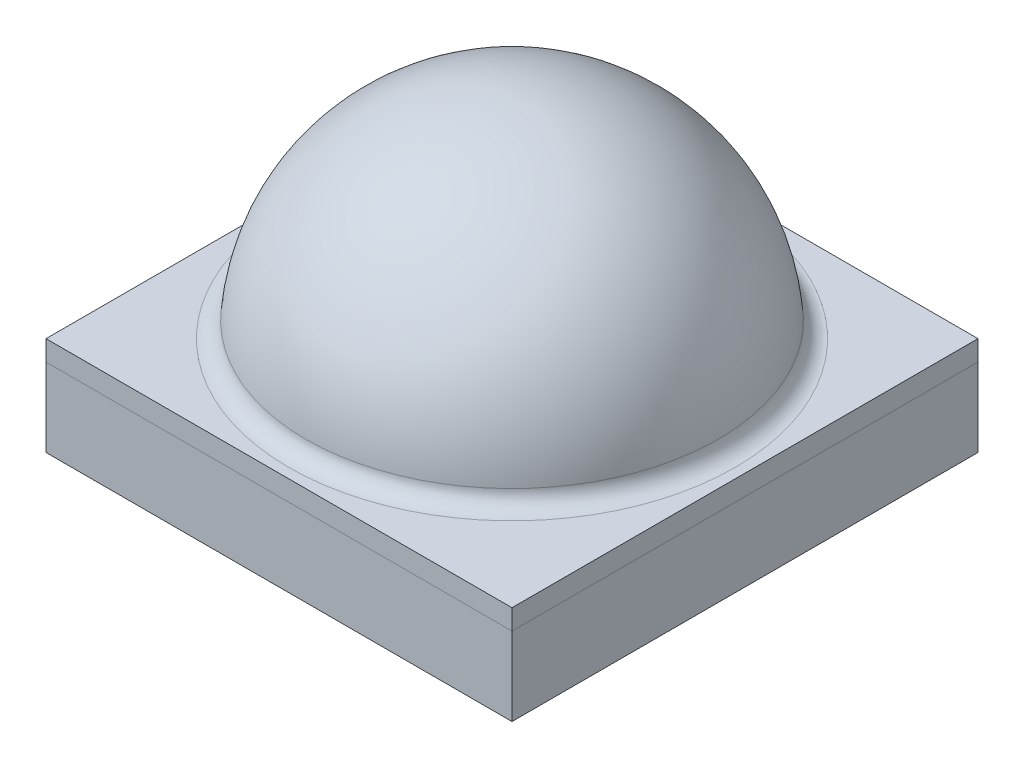
from build123d import *

# Parameters (mm, degrees)
SKETCH1_W           = 3.45
SKETCH1_H           = 3.45
BOSS_EXTRUDE1_DEPTH = 0.58
SKETCH2_W           = 3.45
SKETCH2_H           = 3.45
BOSS_EXTRUDE2_DEPTH = 0.15
FILLET1_R           = 0.127


with BuildPart() as part:
    # Sketch1 → Boss-Extrude1 (new body)
    with BuildSketch(Plane(origin=(0, 0, 0), x_dir=(1, 0, 0), z_dir=(0, 1, 0))):
        Rectangle(SKETCH1_W, SKETCH1_H)
    extrude(amount=BOSS_EXTRUDE1_DEPTH)


with BuildPart() as body_2:
    # Sketch2 → Boss-Extrude2 (new body)
    with BuildSketch(Plane(origin=(0, 0.58, 0), x_dir=(1, 0, 0), z_dir=(0, 1, 0))):
        Rectangle(SKETCH2_W, SKETCH2_H)
    extrude(amount=BOSS_EXTRUDE2_DEPTH)

    # Sketch3 → Revolve1 (revolve)
    with BuildSketch(Plane(origin=(0, 0, 0), x_dir=(0, 0, -1), z_dir=(1, 0, 0))):
        with BuildLine():
            Line((0, 0.73), (1.53, 0.73))
            ThreePointArc((1.53, 0.73), (1.081873375, 1.811873375), (0, 2.26))
            Line((0, 2.26), (0, 0.73))
        make_face()
    revolve(axis=Axis((0, 2.26, 0), (0, -1, 0)))

    # Fillet1
    fillet1_edges = [body_2.edges().sort_by_distance(p)[0] for p in [
        (0, 0.73, 1.53),
    ]]
    fillet(fillet1_edges, radius=FILLET1_R)


solid = Compound([part.part, body_2.part])
